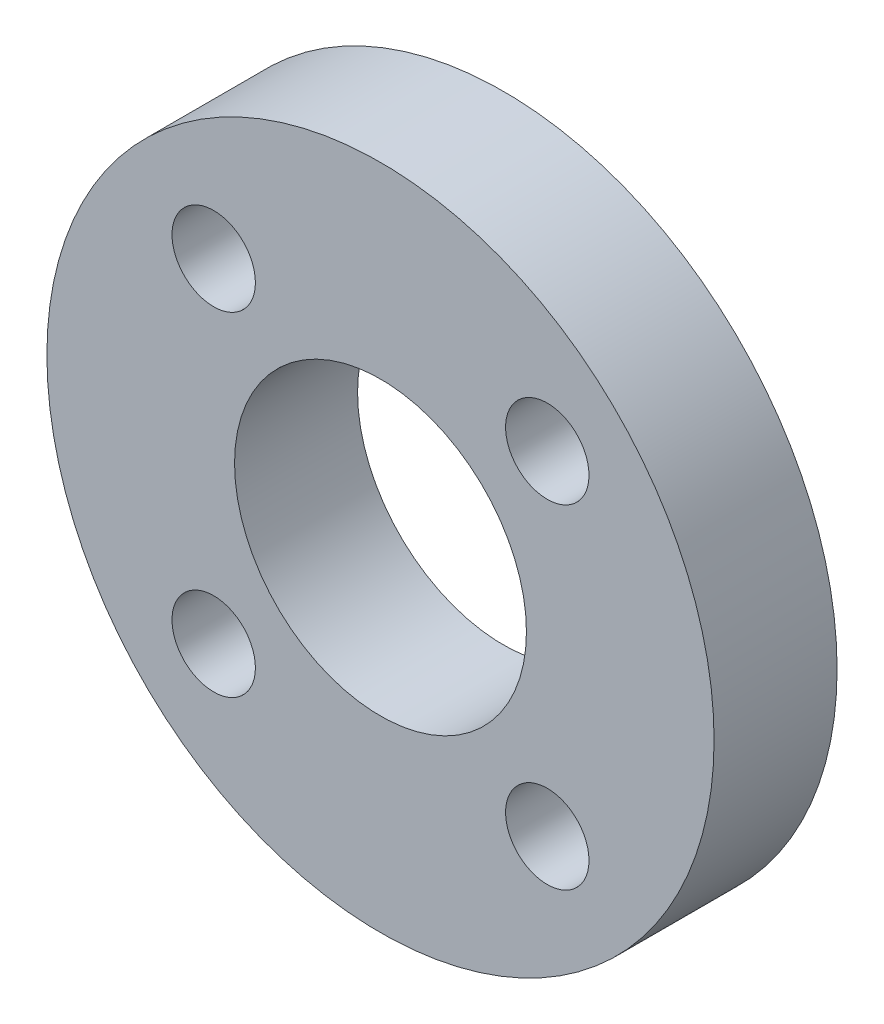
from build123d import *

# Parameters (mm, degrees)
SKETCH1_R           = 16
SKETCH1_R_2         = 7
SKETCH1_R_3         = 2
BOSS_EXTRUDE1_DEPTH = 5.9


with BuildPart() as part:
    # Sketch1 → Boss-Extrude1 (new body)
    with BuildSketch(Plane.XY):
        Circle(SKETCH1_R)
        Circle(SKETCH1_R_2, mode=Mode.SUBTRACT)
        with Locations((-8, 8)):
            Circle(SKETCH1_R_3, mode=Mode.SUBTRACT)
        with Locations((8, 8)):
            Circle(SKETCH1_R_3, mode=Mode.SUBTRACT)
        with Locations((8, -8)):
            Circle(SKETCH1_R_3, mode=Mode.SUBTRACT)
        with Locations((-8, -8)):
            Circle(SKETCH1_R_3, mode=Mode.SUBTRACT)
    extrude(amount=BOSS_EXTRUDE1_DEPTH)


solid = part.part
